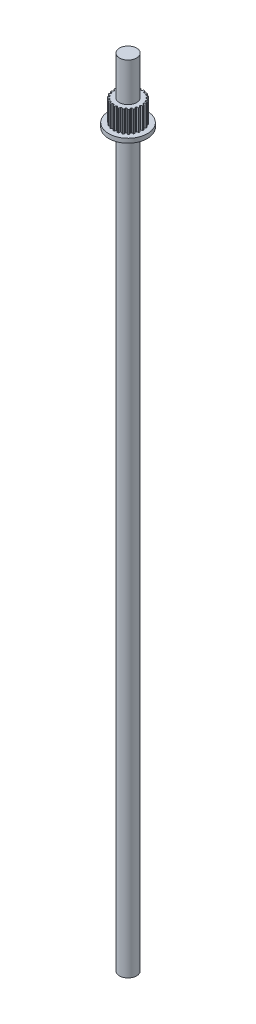
from build123d import *
from build123d.topology import SkipClean

# Parameters (mm, degrees)
SKETCH1_R                = 6
SKETCH1_R_2              = 4
BOSS_EXTRUDE1_DEPTH      = 10
BOSS_EXTRUDE2_DEPTH      = 10
FILLET1_R                = 0.1
CIRPATTERN2_COUNT        = 23
FILLET1_OF_CIRPATTERN2_R = 0.1
BOSS_EXTRUDE4_START      = 2
SKETCH4_R                = 9
SKETCH4_R_2              = 4
BOSS_EXTRUDE4_DEPTH      = 2
BOSS_EXTRUDE3_DEPTH      = 340
BOSS_EXTRUDE3_DEPTH_BACK = 30
SKETCH3_R                = 4


with BuildPart() as part:
    # Sketch1 → Boss-Extrude1 (new body)
    with BuildSketch(Plane(origin=(0, 0, 0), x_dir=(1, 0, 0), z_dir=(0, 1, 0))):
        with Locations(Location((0, 0, 0), (0, 0, 270))):
            Circle(SKETCH1_R)
        with Locations(Location((0, 0, 0), (0, 0, 270))):
            Circle(SKETCH1_R_2, mode=Mode.SUBTRACT)
    extrude(amount=BOSS_EXTRUDE1_DEPTH)

    # Sketch2 → Boss-Extrude2 (add)
    with BuildSketch(Plane.XZ):
        with BuildLine():
            Line((-0.35, 6.74), (0.35, 6.74))
            add(Edge.make_bspline(
                [(0.605, 5.969419989), (0.298714321, 6.295196314), (0.35, 6.74)],
                knots=[0, 0, 0, 1, 1, 1], degree=2))
            Line((0.605, 5.969419989), (0.637444252, 5.692244917))
            Line((0.637444252, 5.692244917), (-0.605, 5.692244917))
            Line((-0.605, 5.692244917), (-0.605, 5.969419989))
            add(Edge.make_bspline(
                [(-0.605, 5.969419989), (-0.298714321, 6.295196314), (-0.35, 6.74)],
                knots=[0, 0, 0, 1, 1, 1], degree=2))
        make_face()
    boss_extrude2 = extrude(amount=-BOSS_EXTRUDE2_DEPTH)

    # Fillet1
    fillet1_edges = [part.edges().sort_by_distance(p)[0] for p in [
        (-0.35, 5, 6.74),
        (0.35, 5, 6.74),
    ]]
    fillet(fillet1_edges, radius=FILLET1_R)

    # CirPattern2: Boss-Extrude2 ×23 about axis
    cirpattern2_axis = Axis((0, 0, 0), (0, -1, 0))
    for i in range(1, CIRPATTERN2_COUNT):
        add(boss_extrude2.rotate(cirpattern2_axis, i * 360 / CIRPATTERN2_COUNT))

    # Fillet1 of CirPattern2
    fillet1_of_cirpattern2_edges = [part.edges().sort_by_distance(p)[0] for p in [
        (-2.155451288, 5, 6.395633647),
        (-1.481409187, 5, 6.584491387),
        (-3.801042615, 5, 5.576932404),
        (-3.202949032, 5, 5.940641169),
        (-5.164727999, 5, 4.344615598),
        (-4.686940799, 5, 4.856200773),
        (-6.145369135, 5, 2.790078528),
        (-5.823323609, 5, 3.411598181),
        (-6.670236356, 5, 1.028614097),
        (-6.527817146, 5, 1.713972959),
        (-6.70040266, 5, -0.809137935),
        (-6.748172349, 5, -0.110769797),
        (-6.233630751, 5, -2.586879909),
        (-6.468046479, 5, -1.927297263),
        (-5.304538966, 5, -4.172764834),
        (-5.708215192, 5, -3.600885909),
        (-3.982033793, 5, -5.44917488),
        (-4.525031697, 5, -5.007413319),
        (-2.36419939, 5, -6.321444554),
        (-3.006247301, 5, -6.042563791),
        (-0.571023134, 5, -6.724881603),
        (-1.264503296, 5, -6.629564949),
        (1.264503296, 5, -6.629564949),
        (0.571023134, 5, -6.724881603),
        (3.006247301, 5, -6.042563791),
        (2.36419939, 5, -6.321444554),
        (4.525031697, 5, -5.007413319),
        (3.982033793, 5, -5.44917488),
        (5.708215192, 5, -3.600885909),
        (5.304538966, 5, -4.172764834),
        (6.468046479, 5, -1.927297263),
        (6.233630751, 5, -2.586879909),
        (6.748172349, 5, -0.110769797),
        (6.70040266, 5, -0.809137935),
        (6.527817146, 5, 1.713972959),
        (6.670236356, 5, 1.028614097),
        (5.823323609, 5, 3.411598181),
        (6.145369135, 5, 2.790078528),
        (4.686940799, 5, 4.856200773),
        (5.164727999, 5, 4.344615598),
        (3.202949032, 5, 5.940641169),
        (3.801042615, 5, 5.576932404),
        (1.481409187, 5, 6.584491387),
        (2.155451288, 5, 6.395633647),
    ]]
    fillet(fillet1_of_cirpattern2_edges, radius=FILLET1_OF_CIRPATTERN2_R)

    # Sketch4 → Boss-Extrude4 (add)
    with SkipClean():  # the faces are left unmerged after this step: merging them gives an invalid solid
        with BuildSketch(Plane.XZ.offset(BOSS_EXTRUDE4_START)):
            with Locations(Location((0, 0, 0), (0, 0, 270))):
                Circle(SKETCH4_R)
            with Locations(Location((0, 0, 0), (0, 0, 270))):
                Circle(SKETCH4_R_2, mode=Mode.SUBTRACT)
        extrude(amount=-BOSS_EXTRUDE4_DEPTH)

    # Sketch3 → Boss-Extrude3 (add, two sides: drawn at the far end of the back side and taken through both)
    with BuildSketch(Plane.XZ.offset(2).offset(-BOSS_EXTRUDE3_DEPTH_BACK)):
        with Locations(Location((0, 0, 0), (0, 0, 270))):
            Circle(SKETCH3_R)
    extrude(amount=BOSS_EXTRUDE3_DEPTH + BOSS_EXTRUDE3_DEPTH_BACK)


solid = part.part
